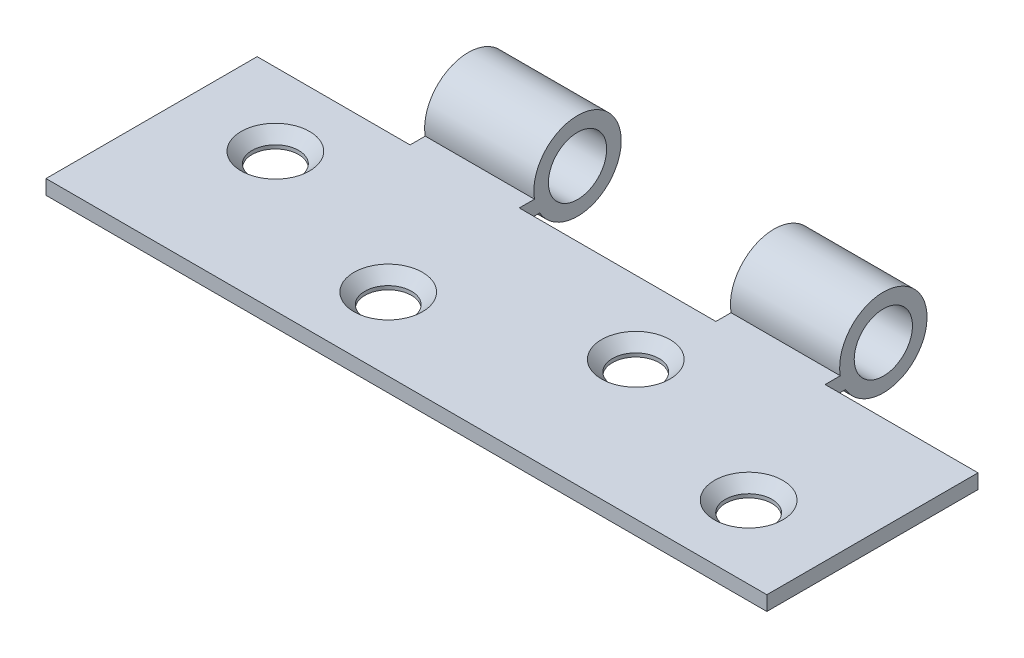
from build123d import *

# Parameters (mm, degrees)
SKETCH_1_R               = 6
SKETCH_1_R_2             = 4
EXTRUDE_1_DEPTH          = 99
SKETCH_2_W               = 99
SKETCH_2_H               = 2
EXTRUDE_2_DEPTH          = 37
SKETCH_3_R               = 4
CUT_EXTRUDE_1_DEPTH      = 106.858395983
SKETCH_7_R               = 3.2
CUT_EXTRUDE_8_DEPTH      = 37
CUT_EXTRUDE_9_DEPTH      = 106.919780967
CUT_EXTRUDE_9_DEPTH_BACK = 106.919780967
SKETCH_8_W               = 21
SKETCH_8_H               = 14
SKETCH_8_W_2             = 27
CHAMFER_2_SIZE           = 1.5


with BuildPart() as part:
    # 草图1 → 凸台-拉伸1 (new body)
    with BuildSketch(Plane(origin=(0, 0, 0), x_dir=(0, 0, -1), z_dir=(1, 0, 0))):
        Circle(SKETCH_1_R)
        Circle(SKETCH_1_R_2, mode=Mode.SUBTRACT)
    extrude(amount=EXTRUDE_1_DEPTH)

    # 草图2 → 凸台-拉伸2 (add)
    with BuildSketch(Plane.XY):
        with Locations((49.5, -2)):
            Rectangle(SKETCH_2_W, SKETCH_2_H)
    extrude(amount=EXTRUDE_2_DEPTH)

    # 草图3 → 切除-拉伸1 (cut, through all)
    with BuildSketch(Plane.ZY):
        with Locations(Location((0, 0, 0), (0, 0, 180))):
            Circle(SKETCH_3_R)
    extrude(amount=-CUT_EXTRUDE_1_DEPTH, mode=Mode.SUBTRACT)

    # 草图7 → 切除-拉伸8 (cut)
    with BuildSketch(Plane.XZ.offset(3)):
        with Locations((12.5, 18)):
            Circle(SKETCH_7_R)
        with Locations((37, 27)):
            Circle(SKETCH_7_R)
        with Locations((62, 18)):
            Circle(SKETCH_7_R)
        with Locations((86.5, 27)):
            Circle(SKETCH_7_R)
    extrude(amount=-CUT_EXTRUDE_8_DEPTH, mode=Mode.SUBTRACT)

    # 草图8 → 切除-拉伸9 (cut, two sides: drawn at the far end of the back side and taken through both)
    with BuildSketch(Plane(origin=(0, -1, 0), x_dir=(1, 0, 0), z_dir=(0, 1, 0)).offset(-CUT_EXTRUDE_9_DEPTH_BACK)):
        with Locations((10.5, -1)):
            Rectangle(SKETCH_8_W, SKETCH_8_H)
        with Locations((49.5, -1)):
            Rectangle(SKETCH_8_W_2, SKETCH_8_H)
        with Locations((88.5, -1)):
            Rectangle(SKETCH_8_W, SKETCH_8_H)
    extrude(amount=CUT_EXTRUDE_9_DEPTH + CUT_EXTRUDE_9_DEPTH_BACK, mode=Mode.SUBTRACT)

    # 倒角2
    chamfer_2_edges = [part.edges().sort_by_distance(p)[0] for p in [
        (9.3, -1, 18),
        (33.8, -1, 27),
        (58.8, -1, 18),
        (83.3, -1, 27),
    ]]
    chamfer(chamfer_2_edges, length=CHAMFER_2_SIZE)


solid = part.part
